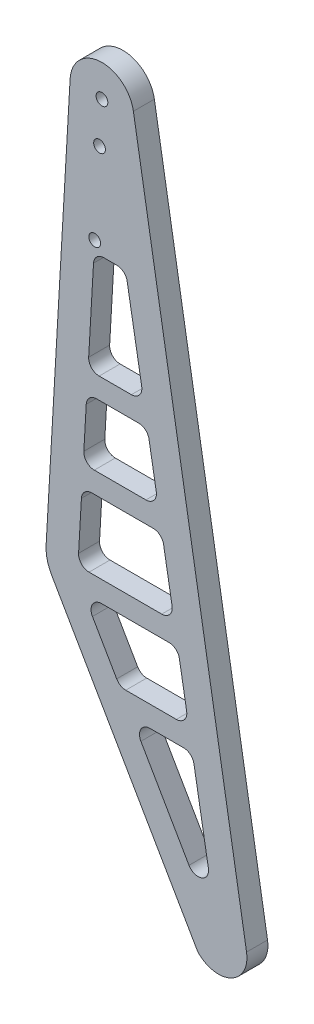
from build123d import *

# Parameters (mm, degrees)
BOSS_EXTRUDE1_DEPTH   = 3.175
FILLET1_R             = 6.35
F_2_56_TAPPED_HOLE2_D = 1.778
CUT_EXTRUDE1_DEPTH    = 75.069947742
FILLET2_R             = 1.5875


with BuildPart() as part:
    # Sketch1 → Boss-Extrude1 (new body)
    with BuildSketch(Plane.XY):
        with BuildLine():
            Line((-4.835969239, 0), (18.250637604, -39.987176027))
            ThreePointArc((18.250637604, -39.987176027), (23.298677844, -40.879278308), (25.623151786, -36.310320261))
            Line((25.623151786, -36.310320261), (8.49045675, 65.376366097))
            ThreePointArc((8.49045675, 65.376366097), (3.466101861, 69.394963614), (-1.090256537, 64.852622125))
            Line((-1.090256537, 64.852622125), (-4.835969239, 0))
        make_face()
    extrude(amount=BOSS_EXTRUDE1_DEPTH)

    # Fillet1
    fillet1_edges = [part.edges().sort_by_distance(p)[0] for p in [
        (-4.835969239, 0, 1.5875),
    ]]
    fillet(fillet1_edges, radius=FILLET1_R)

    # #2-56 Tapped Hole2 (through all)
    with Locations(Plane(origin=(2.631187962, 45.555933465, 3.175), x_dir=(1, 0, 0), z_dir=(0, 0, 1))):
        with Locations((0, 0), (0.732297358, 12.678869847), (1.098446037, 19.01830477)):
            Hole(F_2_56_TAPPED_HOLE2_D / 2)

    # Sketch5 → Cut-Extrude1 (cut, through all)
    with BuildSketch(Plane.XY.offset(3.175)):
        Polygon((2.537667609, 43.936738235), (7.314221402, 43.936738235), (10.071596328, 28.061738235), (1.620770386, 28.061738235), align=None)
        Polygon((1.437390941, 24.886738235), (10.623071313, 24.886738235), (12.277496268, 15.361738235), (0.887252607, 15.361738235), align=None)
        Polygon((0.703873162, 12.186738235), (12.828971253, 12.186738235), (14.669983772, 1.5875), (0.091689722, 1.5875), align=None)
        Polygon((0.916543552, -1.5875), (15.221458757, -1.5875), (16.875883712, -11.1125), (6.415804866, -11.1125), align=None)
        Polygon((21.376833522, -37.025761765), (17.427358698, -14.2875), (8.248891971, -14.2875), align=None)
    extrude(amount=-CUT_EXTRUDE1_DEPTH, mode=Mode.SUBTRACT)

    # Fillet2
    fillet2_edges = [part.edges().sort_by_distance(p)[0] for p in [
        (1.620770386, 28.061738235, 1.5875),
        (2.537667609, 43.936738235, 1.5875),
        (7.314221402, 43.936738235, 1.5875),
        (10.071596328, 28.061738235, 1.5875),
        (6.415804866, -11.1125, 1.5875),
        (0.916543552, -1.5875, 1.5875),
        (15.221458757, -1.5875, 1.5875),
        (16.875883712, -11.1125, 1.5875),
        (0.091689722, 1.5875, 1.5875),
        (0.703873162, 12.186738235, 1.5875),
        (12.828971253, 12.186738235, 1.5875),
        (14.669983772, 1.5875, 1.5875),
        (0.887252607, 15.361738235, 1.5875),
        (1.437390941, 24.886738235, 1.5875),
        (10.623071313, 24.886738235, 1.5875),
        (12.277496268, 15.361738235, 1.5875),
        (21.376833522, -37.025761765, 1.5875),
        (8.248891971, -14.2875, 1.5875),
        (17.427358698, -14.2875, 1.5875),
    ]]
    fillet(fillet2_edges, radius=FILLET2_R)


solid = part.part
